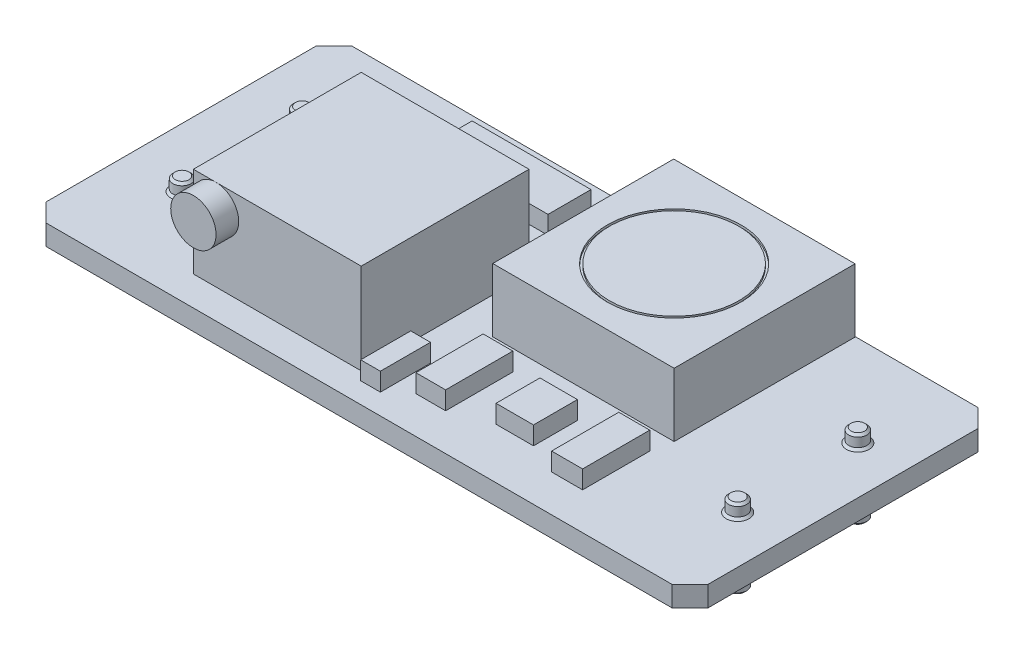
from build123d import *

# Parameters (mm, degrees)
SKETCH1_W                = 37.084
SKETCH1_H                = 17.145
BOSS_EXTRUDE1_DEPTH      = 1.143
BOSS_EXTRUDE2_DEPTH      = 0.762
BOSS_EXTRUDE2_DEPTH_BACK = 3.683
SKETCH2_R                = 0.508
CHAMFER1_SIZE            = 0.127
SKETCH3_W                = 9.398
SKETCH3_H                = 9.398
BOSS_EXTRUDE3_DEPTH      = 5.08
BOSS_EXTRUDE4_DEPTH      = 3.556
SKETCH4_R                = 1.27
BOSS_EXTRUDE5_DEPTH      = 1.27
SKETCH5_R                = 3.7465
SKETCH5_R_2              = 3.6195
CUT_EXTRUDE1_DEPTH       = 0.127
SKETCH6_W                = 6.657539154
SKETCH6_H                = 2.406121488
SKETCH6_W_2              = 1.664384789
SKETCH6_H_2              = 3.762956913
SKETCH6_W_3              = 1.736749344
SKETCH6_W_4              = 2.098572125
SKETCH6_H_3              = 2.460394905
SKETCH6_W_5              = 1.10355948
SKETCH6_H_4              = 2.804126546
BOSS_EXTRUDE6_DEPTH      = 1.016
CHAMFER2_SIZE            = 1.016
SKETCH7_W                = 10.16
SKETCH7_H                = 3.556
CUT_EXTRUDE2_DEPTH       = 0.0254


with BuildPart() as part:
    # Sketch1 → Boss-Extrude1 (new body)
    with BuildSketch(Plane(origin=(0, 0, 0), x_dir=(1, 0, 0), z_dir=(0, 1, 0))):
        with Locations((18.542, 8.5725)):
            Rectangle(SKETCH1_W, SKETCH1_H)
    extrude(amount=BOSS_EXTRUDE1_DEPTH)

    # Sketch2 → Boss-Extrude2 (add, two sides: drawn at the far end of the back side and taken through both)
    with BuildSketch(Plane(origin=(0, 1.143, 0), x_dir=(1, 0, 0), z_dir=(0, 1, 0)).offset(-BOSS_EXTRUDE2_DEPTH_BACK)):
        with Locations((3.302, 12.065)):
            Circle(SKETCH2_R)
        with Locations((3.302, 5.334)):
            Circle(SKETCH2_R)
        with Locations((34.417, 12.065)):
            Circle(SKETCH2_R)
        with Locations((34.417, 5.334)):
            Circle(SKETCH2_R)
    extrude(amount=BOSS_EXTRUDE2_DEPTH + BOSS_EXTRUDE2_DEPTH_BACK)

    # Chamfer1
    chamfer1_edges = [part.edges().sort_by_distance(p)[0] for p in [
        (33.909, -2.54, -5.334),
        (33.909, 0, -5.334),
        (33.909, -2.54, -12.065),
        (33.909, 0, -12.065),
        (2.794, -2.54, -12.065),
        (2.794, 0, -12.065),
        (2.794, -2.54, -5.334),
        (2.794, 0, -5.334),
        (33.909, 1.143, -5.334),
        (33.909, 1.905, -5.334),
        (33.909, 1.143, -12.065),
        (33.909, 1.905, -12.065),
        (2.794, 1.143, -5.334),
        (2.794, 1.905, -5.334),
        (2.794, 1.143, -12.065),
        (2.794, 1.905, -12.065),
    ]]
    chamfer(chamfer1_edges, length=CHAMFER1_SIZE)

    # Sketch3 → Boss-Extrude3 (add)
    with BuildSketch(Plane(origin=(0, 1.143, 0), x_dir=(1, 0, 0), z_dir=(0, 1, 0))):
        with Locations((12.319, 6.35)):
            Rectangle(SKETCH3_W, SKETCH3_H)
    extrude(amount=BOSS_EXTRUDE3_DEPTH)

    # Sketch3<3> → Boss-Extrude4 (add)
    with BuildSketch(Plane(origin=(0, 1.143, 0), x_dir=(1, 0, 0), z_dir=(0, 1, 0))):
        Polygon((19.05, 17.145), (19.05, 11.049), (19.05, 6.985), (29.21, 6.985), (29.21, 17.145), align=None)
    extrude(amount=BOSS_EXTRUDE4_DEPTH)

    # Sketch4 → Boss-Extrude5 (add)
    with BuildSketch(Plane.XY.offset(-1.651)):
        with Locations((8.89, 4.953)):
            Circle(SKETCH4_R)
    extrude(amount=BOSS_EXTRUDE5_DEPTH)

    # Sketch5 → Cut-Extrude1 (cut)
    with BuildSketch(Plane(origin=(0, 4.699, 0), x_dir=(1, 0, 0), z_dir=(0, 1, 0))):
        with Locations((24.13, 12.065)):
            Circle(SKETCH5_R)
        with Locations((24.13, 12.065)):
            Circle(SKETCH5_R_2, mode=Mode.SUBTRACT)
    extrude(amount=-CUT_EXTRUDE1_DEPTH, mode=Mode.SUBTRACT)

    # Sketch6 → Boss-Extrude6 (add)
    with BuildSketch(Plane(origin=(0, 1.143, 0), x_dir=(1, 0, 0), z_dir=(0, 1, 0))):
        with Locations((12.34578489, 14.660168276)):
            Rectangle(SKETCH6_W, SKETCH6_H)
        with Locations((20.486797444, 3.959259553)):
            Rectangle(SKETCH6_W_2, SKETCH6_H_2)
        with Locations((28.121258104, 3.959259553)):
            Rectangle(SKETCH6_W_3, SKETCH6_H_2)
        with Locations((24.430665747, 4.067806388)):
            Rectangle(SKETCH6_W_4, SKETCH6_H_3)
        with Locations((18.035448108, 2.55719628)):
            Rectangle(SKETCH6_W_5, SKETCH6_H_4)
    extrude(amount=BOSS_EXTRUDE6_DEPTH)

    # Chamfer2
    chamfer2_edges = [part.edges().sort_by_distance(p)[0] for p in [
        (37.084, 0.5715, 0),
        (37.084, 0.5715, -17.145),
        (0, 0.5715, -17.145),
        (0, 0.5715, 0),
    ]]
    chamfer(chamfer2_edges, length=CHAMFER2_SIZE)

    # Sketch7 → Cut-Extrude2 (cut)
    with BuildSketch(Plane(origin=(0, 0, -17.145), x_dir=(-1, 0, 0), z_dir=(0, 0, -1))):
        with Locations((-24.13, 2.921)):
            Rectangle(SKETCH7_W, SKETCH7_H)
    extrude(amount=-CUT_EXTRUDE2_DEPTH, mode=Mode.SUBTRACT)


solid = part.part
